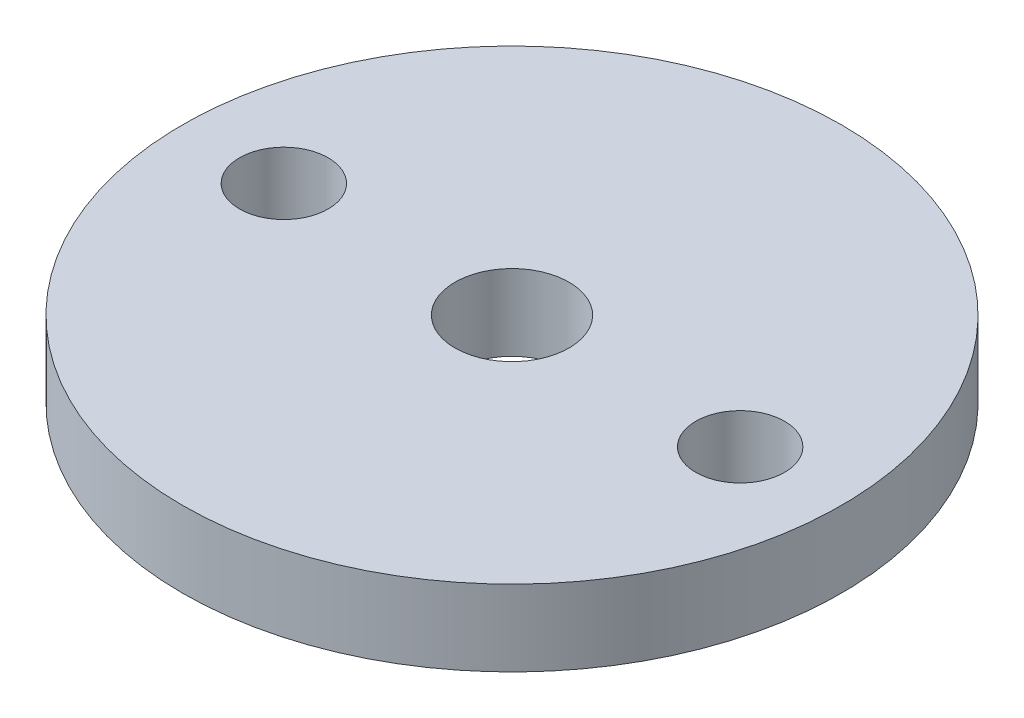
from build123d import *

# Parameters (mm, degrees)
SKETCH1_R           = 13
BOSS_EXTRUDE1_DEPTH = 3
SKETCH3_R           = 2.25
CUT_EXTRUDE1_DEPTH  = 3
SKETCH2_R           = 1.75
CUT_EXTRUDE2_DEPTH  = 3


with BuildPart() as part:
    # Sketch1 → Boss-Extrude1 (new body)
    with BuildSketch(Plane(origin=(0, 0, 0), x_dir=(1, 0, 0), z_dir=(0, 1, 0))):
        with Locations(Location((0, 0, 0), (0, 0, 270))):
            Circle(SKETCH1_R)
    extrude(amount=BOSS_EXTRUDE1_DEPTH)

    # Sketch3 → Cut-Extrude1 (cut)
    with BuildSketch(Plane(origin=(0, 3, 0), x_dir=(1, 0, 0), z_dir=(0, 1, 0))):
        with Locations(Location((0, 0, 0), (0, 0, 270))):
            Circle(SKETCH3_R)
    extrude(amount=-CUT_EXTRUDE1_DEPTH, mode=Mode.SUBTRACT)

    # Sketch2 → Cut-Extrude2 (cut)
    with BuildSketch(Plane(origin=(0, 3, 0), x_dir=(1, 0, 0), z_dir=(0, 1, 0))):
        with Locations(Location((9, 0, 0), (0, 0, 270))):
            Circle(SKETCH2_R)
    cut_extrude2 = extrude(amount=-CUT_EXTRUDE2_DEPTH, mode=Mode.SUBTRACT)

    # Mirror1: Cut-Extrude2 across plane
    add(cut_extrude2.mirror(Plane(origin=(0, 0, 0), x_dir=(0, 0, 1), z_dir=(1, 0, 0))), mode=Mode.SUBTRACT)


solid = part.part
